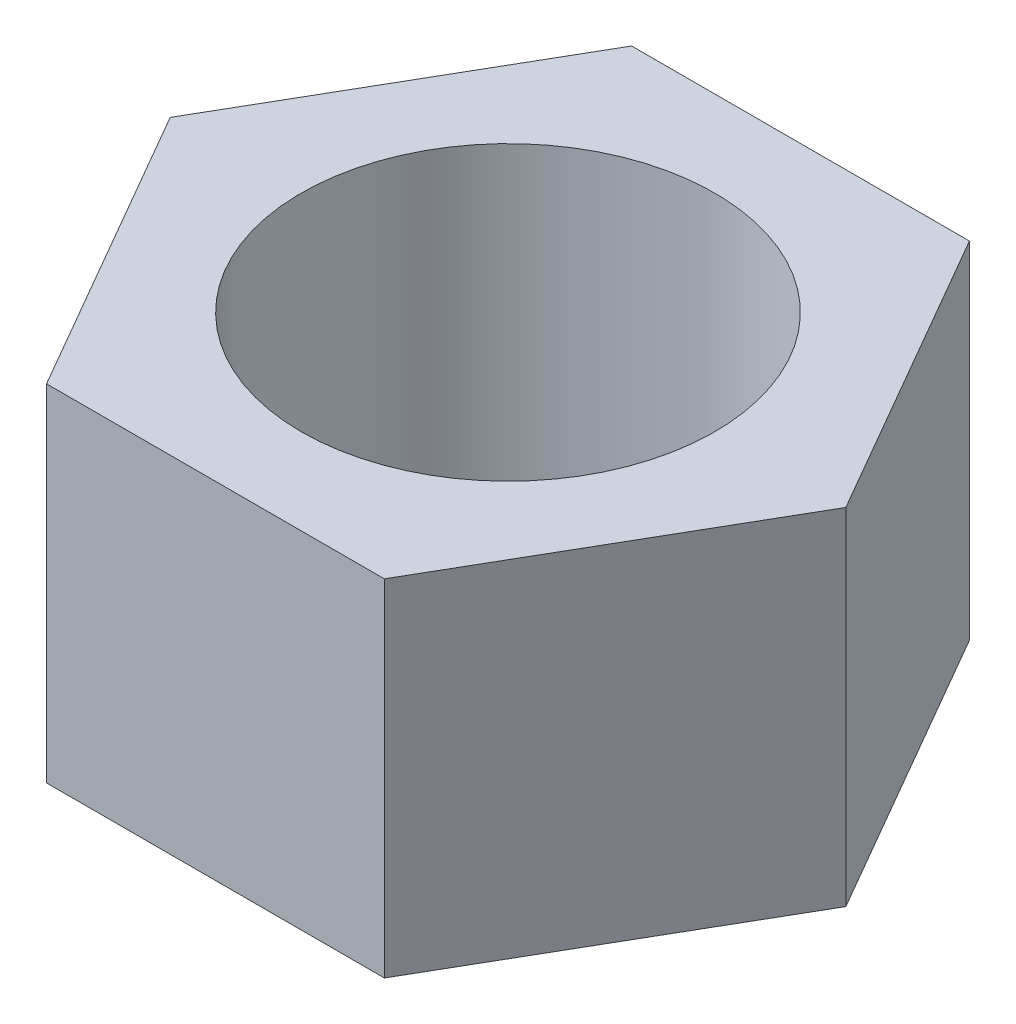
from build123d import *

# Parameters (mm, degrees)
BOSS_EXTRUDE1_DEPTH = 8.36
SKETCH2_R           = 5
CUT_EXTRUDE1_DEPTH  = 8.36


with BuildPart() as part:
    # Sketch1 → Boss-Extrude1 (new body)
    with BuildSketch(Plane(origin=(0, 0, 0), x_dir=(1, 0, 0), z_dir=(0, 1, 0))):
        Polygon((8.169506309, 0), (4.084753155, 7.075), (-4.084753155, 7.075), (-8.169506309, 0), (-4.084753155, -7.075), (4.084753155, -7.075), align=None)
    extrude(amount=BOSS_EXTRUDE1_DEPTH)

    # Sketch2 → Cut-Extrude1 (cut)
    with BuildSketch(Plane(origin=(0, 8.36, 0), x_dir=(1, 0, 0), z_dir=(0, 1, 0))):
        with Locations(Location((0, 0, 0), (0, 0, 270))):
            Circle(SKETCH2_R)
    extrude(amount=-CUT_EXTRUDE1_DEPTH, mode=Mode.SUBTRACT)


solid = part.part
